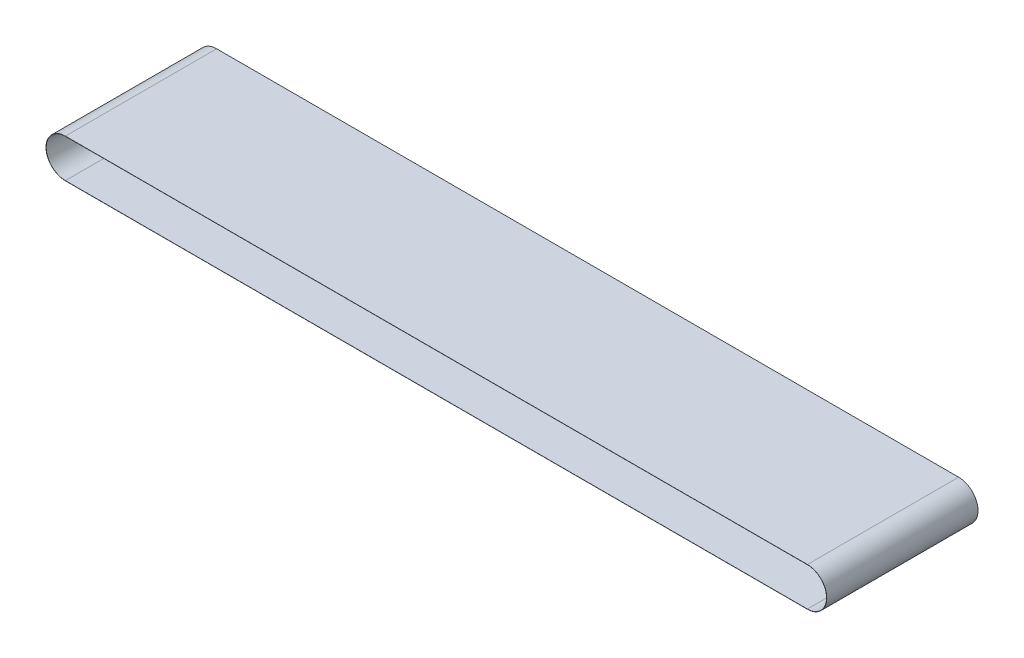
from build123d import *

# Parameters (mm, degrees)
EXTRUDE_1_DEPTH = 80


with BuildPart() as part:
    # 草图1 → 凸台-拉伸1 (new body)
    with BuildSketch(Plane.XY):
        with BuildLine():
            Line((0, 10.25), (392.5, 10.25))
            ThreePointArc((392.5, 10.25), (402.75, 0), (392.5, -10.25))
            Line((392.5, -10.25), (0, -10.25))
            ThreePointArc((0, -10.25), (-10.25, 0), (0, 10.25))
        make_face()
        with BuildLine():
            Line((0, 10.15), (392.5, 10.15))
            ThreePointArc((392.5, 10.15), (402.65, 0), (392.5, -10.15))
            Line((392.5, -10.15), (0, -10.15))
            ThreePointArc((0, -10.15), (-10.15, 0), (0, 10.15))
        make_face(mode=Mode.SUBTRACT)
    extrude(amount=EXTRUDE_1_DEPTH)


solid = part.part
